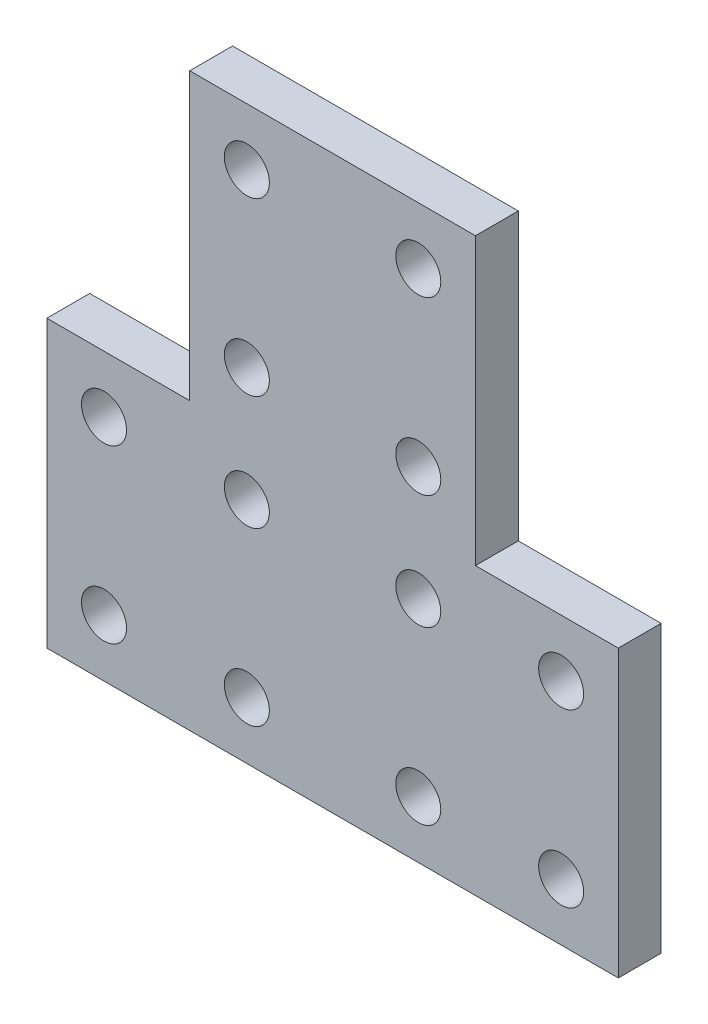
from build123d import *

# Parameters (mm, degrees)
EXTRUDE_1_DEPTH     = 3
SKETCH_2_R          = 1.575
CUT_EXTRUDE_1_DEPTH = 3


with BuildPart() as part:
    # 草图1 → 凸台-拉伸1 (new body)
    with BuildSketch(Plane.XY):
        Polygon((0, 0), (40, 0), (40, 20), (30, 20), (30, 40), (10, 40), (10, 20), (0, 20), align=None)
    extrude(amount=EXTRUDE_1_DEPTH)

    # 草图2 → 切除-拉伸1 (cut)
    with BuildSketch(Plane.XY.offset(3)):
        with Locations((14, 36)):
            Circle(SKETCH_2_R)
        with Locations((26, 36)):
            Circle(SKETCH_2_R)
        with Locations((26, 24)):
            Circle(SKETCH_2_R)
        with Locations((14, 24)):
            Circle(SKETCH_2_R)
        with Locations((4, 16)):
            Circle(SKETCH_2_R)
        with Locations((4, 4)):
            Circle(SKETCH_2_R)
        with Locations((14, 16)):
            Circle(SKETCH_2_R)
        with Locations((14, 4)):
            Circle(SKETCH_2_R)
        with Locations((36, 16)):
            Circle(SKETCH_2_R)
        with Locations((36, 4)):
            Circle(SKETCH_2_R)
        with Locations((26, 4)):
            Circle(SKETCH_2_R)
        with Locations((26, 16)):
            Circle(SKETCH_2_R)
    extrude(amount=-CUT_EXTRUDE_1_DEPTH, mode=Mode.SUBTRACT)


solid = part.part
